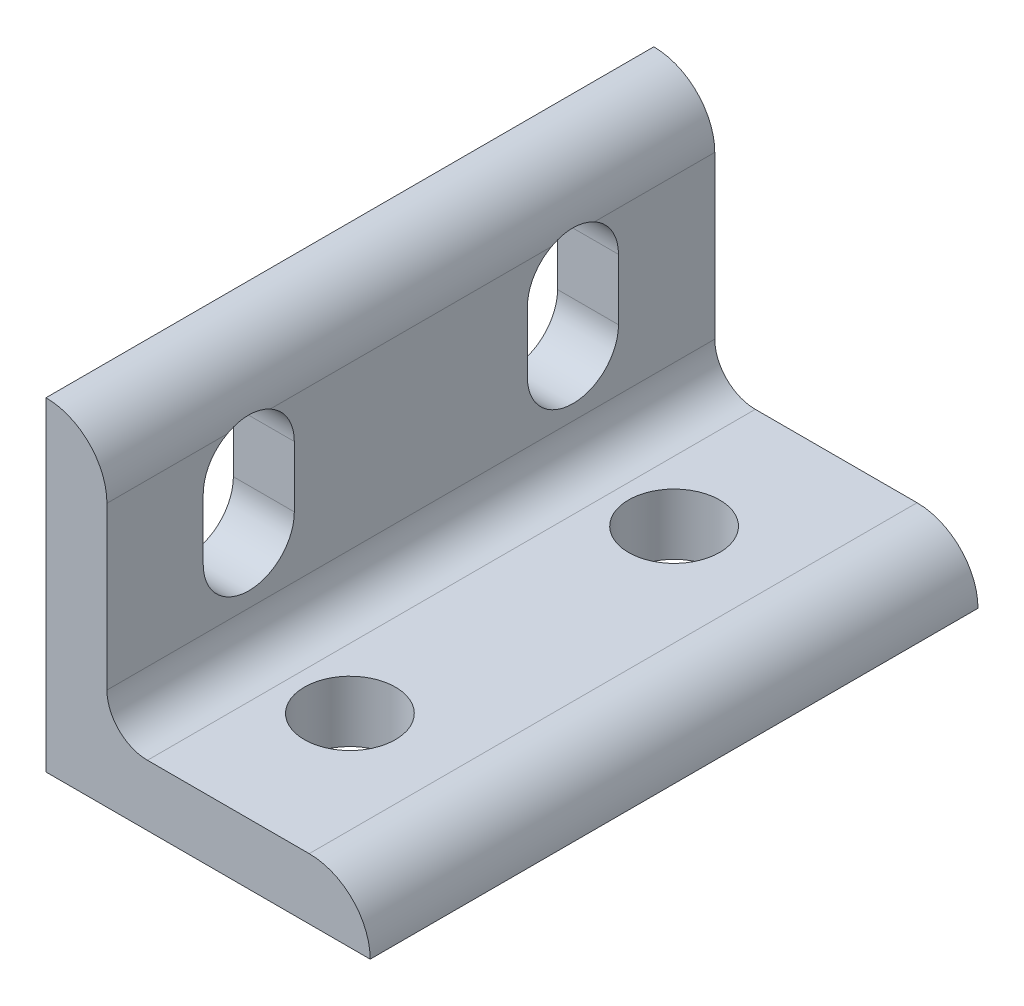
from build123d import *

# Parameters (mm, degrees)
BOSS_EXTRUDE1_DEPTH      = 23.8125
BOSS_EXTRUDE1_DEPTH_BACK = 23.8125
CUT_EXTRUDE1_DEPTH       = 34.966270494
CUT_EXTRUDE1_DEPTH_BACK  = 34.966270494
SKETCH6_R                = 3.5687
CUT_EXTRUDE2_DEPTH       = 34.966270662


with BuildPart() as part:
    # Sketch4 → Boss-Extrude1 (new, two sides: drawn at the far end of the back side and taken through both)
    with BuildSketch(Plane.XY.offset(-BOSS_EXTRUDE1_DEPTH_BACK)):
        with BuildLine():
            Line((-12.7, 12.7), (-12.7, -12.7))
            Line((-12.7, -12.7), (12.7, -12.7))
            ThreePointArc((12.7, -12.7), (11.301376302, -9.323423698), (7.9248, -7.9248))
            Line((7.9248, -7.9248), (-4.7498, -7.9248))
            ThreePointArc((-4.7498, -7.9248), (-6.99486403, -6.99486403), (-7.9248, -4.7498))
            Line((-7.9248, -4.7498), (-7.9248, 7.9248))
            ThreePointArc((-7.9248, 7.9248), (-9.323423698, 11.301376302), (-12.7, 12.7))
        make_face()
    extrude(amount=BOSS_EXTRUDE1_DEPTH + BOSS_EXTRUDE1_DEPTH_BACK)

    # Sketch5 → Cut-Extrude1 (cut, two sides: drawn at the far end of the back side and taken through both)
    with BuildSketch(Plane(origin=(-7.9248, 0, 0), x_dir=(0, 0, -1), z_dir=(1, 0, 0)).offset(-CUT_EXTRUDE1_DEPTH_BACK)):
        with BuildLine():
            Line((-9.1313, 4.7752), (-9.1313, 0))
            ThreePointArc((-9.1313, 0), (-12.7, -3.5687), (-16.2687, 0))
            Line((-16.2687, 0), (-16.2687, 4.7752))
            ThreePointArc((-16.2687, 4.7752), (-12.7, 8.3439), (-9.1313, 4.7752))
        make_face()
        with BuildLine():
            Line((9.1313, 4.7752), (9.1313, 0))
            ThreePointArc((9.1313, 0), (12.7, -3.5687), (16.2687, 0))
            Line((16.2687, 0), (16.2687, 4.7752))
            ThreePointArc((16.2687, 4.7752), (12.7, 8.3439), (9.1313, 4.7752))
        make_face()
    extrude(amount=CUT_EXTRUDE1_DEPTH + CUT_EXTRUDE1_DEPTH_BACK, mode=Mode.SUBTRACT)

    # Sketch6 → Cut-Extrude2 (cut, through all)
    with BuildSketch(Plane(origin=(0, -7.9248, 0), x_dir=(1, 0, 0), z_dir=(0, 1, 0))):
        with Locations(Location((0, -12.7, 0), (0, 0, 180))):
            Circle(SKETCH6_R)
        with Locations((0, 12.7)):
            Circle(SKETCH6_R)
    extrude(amount=-CUT_EXTRUDE2_DEPTH, mode=Mode.SUBTRACT)


solid = part.part
